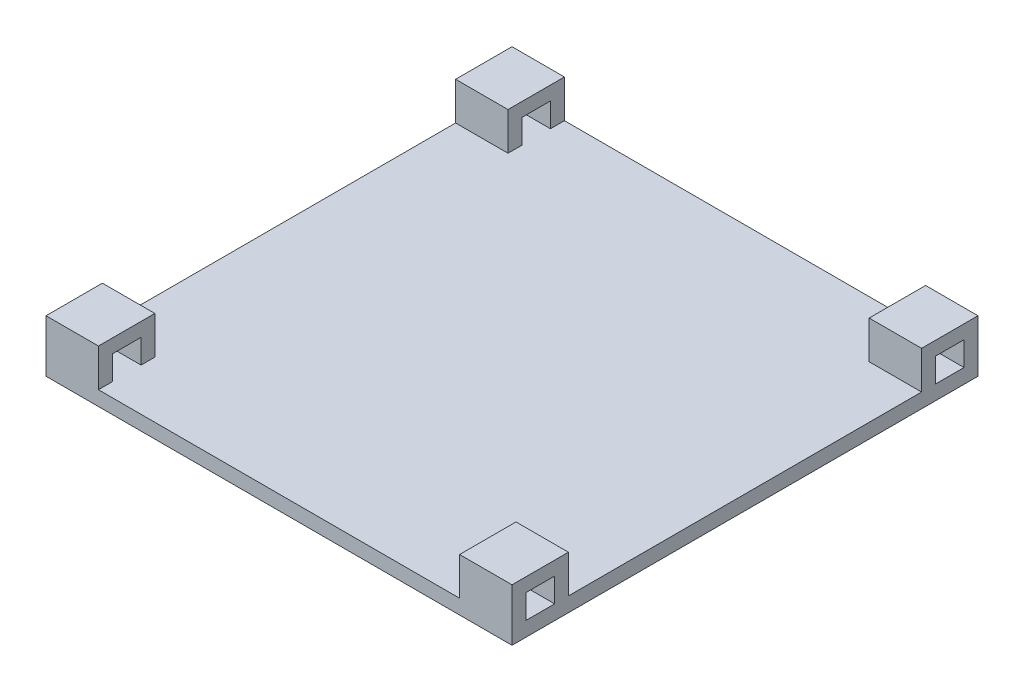
from build123d import *

# Parameters (mm, degrees)
SKETCH2_W           = 203.2
SKETCH2_H           = 203.2
BOSS_EXTRUDE1_DEPTH = 6.35
SKETCH3_W           = 22.86
SKETCH3_H           = 24.6
BOSS_EXTRUDE2_DEPTH = 16.51
CUT_EXTRUDE1_START  = -203.2
SKETCH4_W           = 12.508
SKETCH4_H           = 10.508
CUT_EXTRUDE1_DEPTH  = 203.2


with BuildPart() as part:
    # Sketch2 → Boss-Extrude1 (new body)
    with BuildSketch(Plane(origin=(0, 0, 0), x_dir=(1, 0, 0), z_dir=(0, 1, 0))):
        with Locations((101.6, -101.6)):
            Rectangle(SKETCH2_W, SKETCH2_H)
    extrude(amount=BOSS_EXTRUDE1_DEPTH)

    # Sketch3 → Boss-Extrude2 (add)
    with BuildSketch(Plane(origin=(0, 6.35, 0), x_dir=(1, 0, 0), z_dir=(0, 1, 0))):
        with Locations((191.77, -190.9)):
            Rectangle(SKETCH3_W, SKETCH3_H)
        with Locations((11.43, -190.9)):
            Rectangle(SKETCH3_W, SKETCH3_H)
        with Locations((11.43, -12.3)):
            Rectangle(SKETCH3_W, SKETCH3_H)
        with Locations((191.77, -12.3)):
            Rectangle(SKETCH3_W, SKETCH3_H)
    extrude(amount=BOSS_EXTRUDE2_DEPTH)

    # Sketch4 → Cut-Extrude1 (cut)
    with BuildSketch(Plane(origin=(203.2, 0, 0), x_dir=(0, 0, -1), z_dir=(1, 0, 0)).offset(CUT_EXTRUDE1_START)):
        with Locations((-190.85, 11.604)):
            Rectangle(SKETCH4_W, SKETCH4_H)
        with Locations((-12.35, 11.604)):
            Rectangle(SKETCH4_W, SKETCH4_H)
    extrude(amount=CUT_EXTRUDE1_DEPTH, mode=Mode.SUBTRACT)


solid = part.part
